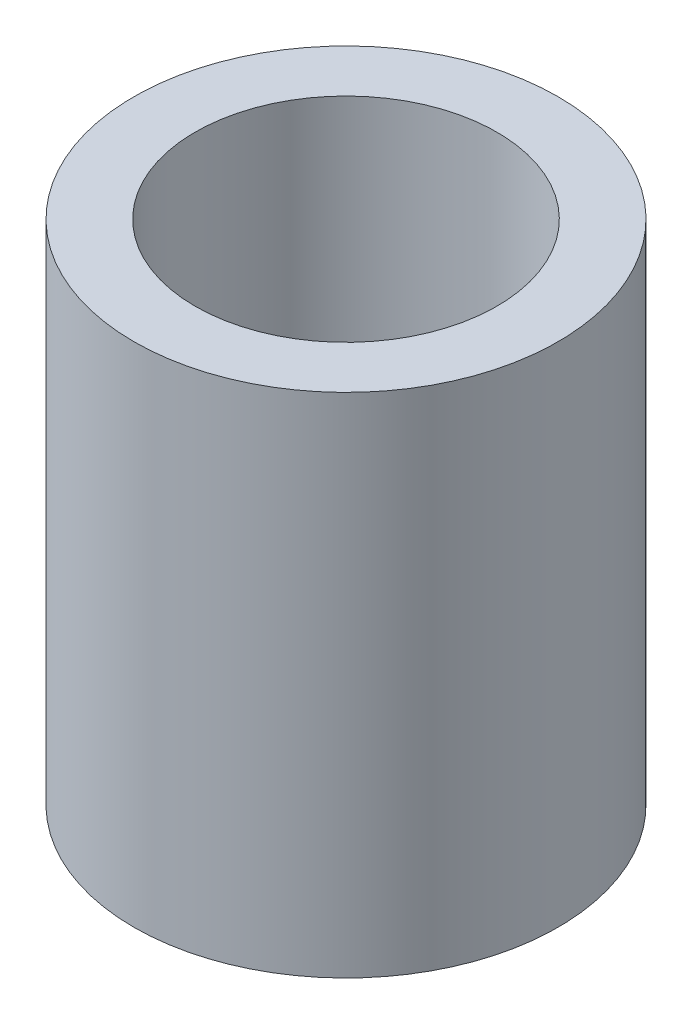
from build123d import *

# Parameters (mm, degrees)
SKETCH1_R           = 2.25
SKETCH1_R_2         = 1.6
BOSS_EXTRUDE1_DEPTH = 5.379


with BuildPart() as part:
    # Sketch1 → Boss-Extrude1 (new body)
    with BuildSketch(Plane(origin=(0, 0, 0), x_dir=(1, 0, 0), z_dir=(0, 1, 0))):
        with Locations(Location((0, 0, 0), (0, 0, 270))):
            Circle(SKETCH1_R)
        with Locations(Location((0, 0, 0), (0, 0, 270))):
            Circle(SKETCH1_R_2, mode=Mode.SUBTRACT)
    extrude(amount=BOSS_EXTRUDE1_DEPTH)


solid = part.part
